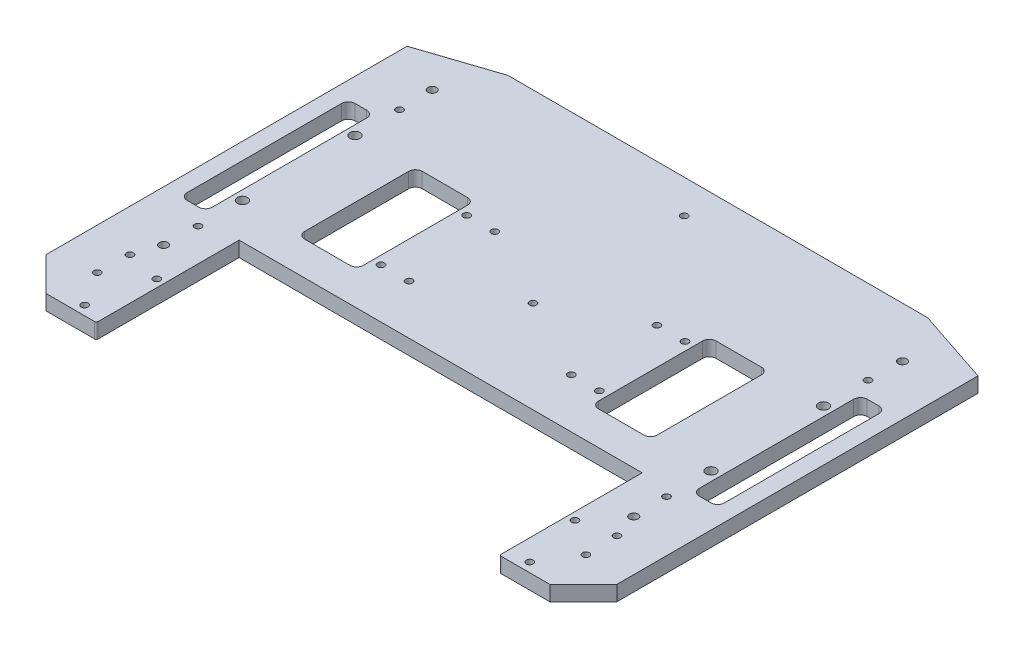
from build123d import *

# Parameters (mm, degrees)
ESQUISSE3_R          = 2.55
STRUCTURE_DEPTH      = 9
ESQUISSE4_R          = 3.05
ENCOCHES_TIGES_DEPTH = 5
ESQUISSE5_R          = 2.05
ENCODEURS_DEPTH      = 221.410979763
MOTEURS_DEPTH        = 221.410979763
MOTEURS_DEPTH_BACK   = 221.410979763
ESQUISSE6_R          = 2.05
ESQUISSE7_R          = 2.05
PATINS_DEPTH         = 221.410979763
ESQUISSE8_R          = 2.05
ACTIONNEURS_DEPTH    = 221.410979763
CONG_1_R             = 1


with BuildPart() as part:
    # Esquisse3 → structure (new body)
    with BuildSketch(Plane(origin=(0, 0, 0), x_dir=(1, 0, 0), z_dir=(0, 1, 0))):
        Polygon((125, 110), (-125, 110), (-170, 95), (-170, 0), (-170, -120), (-150, -140), (-120, -140), (-120, -55), (120, -55), (120, -140), (150, -140), (170, -120), (170, 0), (170, 95), align=None)
        with Locations(Location((-140, 80, 0), (0, 0, 270))):
            Circle(ESQUISSE3_R, mode=Mode.SUBTRACT)
        with Locations(Location((-140, -80, 0), (0, 0, 90))):
            Circle(ESQUISSE3_R, mode=Mode.SUBTRACT)
        with Locations(Location((140, -80, 0), (0, 0, 270))):
            Circle(ESQUISSE3_R, mode=Mode.SUBTRACT)
        with Locations(Location((140, 80, 0), (0, 0, 90))):
            Circle(ESQUISSE3_R, mode=Mode.SUBTRACT)
        with BuildLine():
            Line((-160, -46), (-160, 46))
            ThreePointArc((-160, 46), (-158.828427125, 48.828427125), (-156, 50))
            Line((-156, 50), (-149, 50))
            ThreePointArc((-149, 50), (-146.171572875, 48.828427125), (-145, 46))
            Line((-145, 46), (-145, -46))
            ThreePointArc((-145, -46), (-146.171572875, -48.828427125), (-149, -50))
            Line((-149, -50), (-156, -50))
            ThreePointArc((-156, -50), (-158.828427125, -48.828427125), (-160, -46))
        make_face(mode=Mode.SUBTRACT)
        with BuildLine():
            Line((-105, 0), (-105, 31))
            ThreePointArc((-105, 31), (-103.828427125, 33.828427125), (-101, 35))
            Line((-101, 35), (-74, 35))
            ThreePointArc((-74, 35), (-71.171572875, 33.828427125), (-70, 31))
            Line((-70, 31), (-70, -31))
            ThreePointArc((-70, -31), (-71.171572875, -33.828427125), (-74, -35))
            Line((-74, -35), (-101, -35))
            ThreePointArc((-101, -35), (-103.828427125, -33.828427125), (-105, -31))
            Line((-105, -31), (-105, 0))
        make_face(mode=Mode.SUBTRACT)
        with BuildLine():
            Line((156, 50), (149, 50))
            ThreePointArc((149, 50), (146.171572875, 48.828427125), (145, 46))
            Line((145, 46), (145, -46))
            ThreePointArc((145, -46), (146.171572875, -48.828427125), (149, -50))
            Line((149, -50), (156, -50))
            ThreePointArc((156, -50), (158.828427125, -48.828427125), (160, -46))
            Line((160, -46), (160, 46))
            ThreePointArc((160, 46), (158.828427125, 48.828427125), (156, 50))
        make_face(mode=Mode.SUBTRACT)
        with BuildLine():
            Line((105, 0), (105, 31))
            ThreePointArc((105, 31), (103.828427125, 33.828427125), (101, 35))
            Line((101, 35), (74, 35))
            ThreePointArc((74, 35), (71.171572875, 33.828427125), (70, 31))
            Line((70, 31), (70, -31))
            ThreePointArc((70, -31), (71.171572875, -33.828427125), (74, -35))
            Line((74, -35), (101, -35))
            ThreePointArc((101, -35), (103.828427125, -33.828427125), (105, -31))
            Line((105, -31), (105, 0))
        make_face(mode=Mode.SUBTRACT)
    extrude(amount=-STRUCTURE_DEPTH)

    # Esquisse4 → encoches_tiges (cut)
    with BuildSketch(Plane(origin=(0, 0, 0), x_dir=(1, 0, 0), z_dir=(0, 1, 0))):
        with Locations(Location((-139.5, 33.5, 0), (0, 0, 270))):
            Circle(ESQUISSE4_R)
        with Locations(Location((-139.5, -33.5, 0), (0, 0, 90))):
            Circle(ESQUISSE4_R)
        with Locations(Location((139.5, -33.5, 0), (0, 0, 270))):
            Circle(ESQUISSE4_R)
        with Locations(Location((139.5, 33.5, 0), (0, 0, 90))):
            Circle(ESQUISSE4_R)
    extrude(amount=-ENCOCHES_TIGES_DEPTH, mode=Mode.SUBTRACT)

    # Esquisse5 → encodeurs (cut, through all)
    with BuildSketch(Plane(origin=(0, 0, 0), x_dir=(1, 0, 0), z_dir=(0, 1, 0))):
        with Locations(Location((-139.5, 60, 0), (0, 0, 270))):
            Circle(ESQUISSE5_R)
        with Locations(Location((-139.5, -60, 0), (0, 0, 90))):
            Circle(ESQUISSE5_R)
        with Locations(Location((139.5, -60, 0), (0, 0, 270))):
            Circle(ESQUISSE5_R)
        with Locations(Location((139.5, 60, 0), (0, 0, 90))):
            Circle(ESQUISSE5_R)
    extrude(amount=-ENCODEURS_DEPTH, mode=Mode.SUBTRACT)

    # Esquisse6 → moteurs (cut, two sides: drawn at the far end of the back side and taken through both)
    with BuildSketch(Plane(origin=(0, 0, 0), x_dir=(1, 0, 0), z_dir=(0, 1, 0)).offset(-MOTEURS_DEPTH_BACK)):
        with Locations(Location((-65, 25.5, 0), (0, 0, 270))):
            Circle(ESQUISSE6_R)
        with Locations(Location((-48.3, 25.5, 0), (0, 0, 270))):
            Circle(ESQUISSE6_R)
        with Locations(Location((-65, -25.5, 0), (0, 0, 270))):
            Circle(ESQUISSE6_R)
        with Locations(Location((48.3, -25.5, 0), (0, 0, 270))):
            Circle(ESQUISSE6_R)
        with Locations(Location((65, -25.5, 0), (0, 0, 270))):
            Circle(ESQUISSE6_R)
        with Locations(Location((-48.3, -25.5, 0), (0, 0, 90))):
            Circle(ESQUISSE6_R)
        with Locations(Location((48.3, 25.5, 0), (0, 0, 90))):
            Circle(ESQUISSE6_R)
        with Locations(Location((65, 25.5, 0), (0, 0, 90))):
            Circle(ESQUISSE6_R)
    extrude(amount=MOTEURS_DEPTH + MOTEURS_DEPTH_BACK, mode=Mode.SUBTRACT)

    # Esquisse7 → patins (cut, through all)
    with BuildSketch(Plane(origin=(0, 0, 0), x_dir=(1, 0, 0), z_dir=(0, 1, 0))):
        with Locations(Location((0, 90, 0), (0, 0, 270))):
            Circle(ESQUISSE7_R)
        with Locations(Location((0, 0, 0), (0, 0, 270))):
            Circle(ESQUISSE7_R)
        with Locations(Location((-145, -95, 0), (0, 0, 270))):
            Circle(ESQUISSE7_R)
        with Locations(Location((145, -95, 0), (0, 0, 90))):
            Circle(ESQUISSE7_R)
    extrude(amount=-PATINS_DEPTH, mode=Mode.SUBTRACT)

    # Esquisse8 → actionneurs (cut, through all)
    with BuildSketch(Plane(origin=(0, 0, 0), x_dir=(1, 0, 0), z_dir=(0, 1, 0))):
        with Locations(Location((-132.5, -134.5, 0), (0, 0, 270))):
            Circle(ESQUISSE8_R)
        with Locations(Location((-124.5, -99.5, 0), (0, 0, 270))):
            Circle(ESQUISSE8_R)
        with Locations(Location((132.5, -134.5, 0), (0, 0, 90))):
            Circle(ESQUISSE8_R)
        with Locations(Location((124.5, -99.5, 0), (0, 0, 90))):
            Circle(ESQUISSE8_R)
        with Locations(Location((-145.5, -114, 0), (0, 0, 270))):
            Circle(ESQUISSE8_R)
        with Locations(Location((145.5, -114, 0), (0, 0, 90))):
            Circle(ESQUISSE8_R)
    extrude(amount=-ACTIONNEURS_DEPTH, mode=Mode.SUBTRACT)

    # Congé1
    cong_1_edges = [part.edges().sort_by_distance(p)[0] for p in [
        (-120, -4.5, 140),
        (120, -4.5, 140),
    ]]
    fillet(cong_1_edges, radius=CONG_1_R)


solid = part.part
